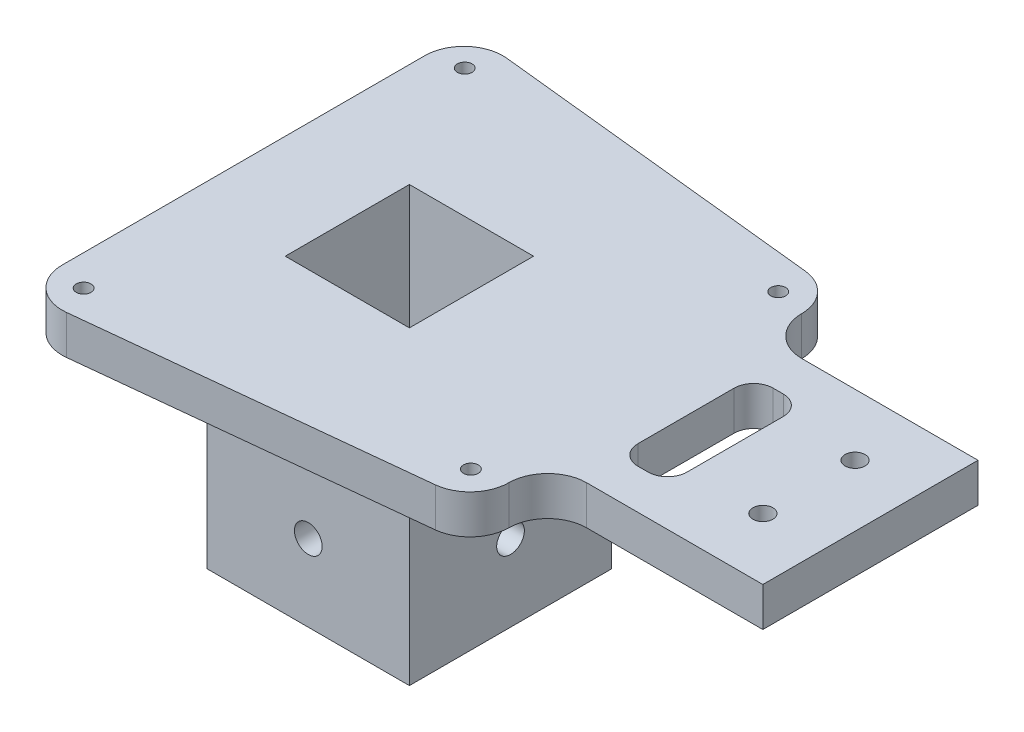
from build123d import *

# Parameters (mm, degrees)
SKETCH1_W            = 32.9
SKETCH1_H            = 32.9
SKETCH1_W_2          = 20.2
SKETCH1_H_2          = 20.2
BOSS_EXTRUDE1_DEPTH  = 25
M4_CLEARANCE_HOLE1_D = 4.5
M4_CLEARANCE_HOLE2_D = 4.5
SKETCH8_W            = 32.9
SKETCH8_H            = 32.9
SKETCH8_W_2          = 20.2
SKETCH8_H_2          = 20.2
BOSS_EXTRUDE2_DEPTH  = 12.7
SKETCH9_W            = 87.4
SKETCH9_H            = 82.4
BOSS_EXTRUDE3_DEPTH  = 6.35
M2_CLEARANCE_HOLE1_D = 2.4
SKETCH13_W           = 20.2
SKETCH13_H           = 20.2
CUT_EXTRUDE1_DEPTH   = 71.911353111
SKETCH14_W           = 87.4
SKETCH14_H           = 82.4
CUT_EXTRUDE2_DEPTH   = 75.481759512
SKETCH15_W           = 35
SKETCH15_H           = 35
SKETCH15_R           = 1.625
BOSS_EXTRUDE4_DEPTH  = 6.35
FILLET1_R            = 6.35
SKETCH16_W           = 8
SKETCH16_H           = 22
CUT_EXTRUDE3_DEPTH   = 95.077926699
FILLET2_R            = 3.175


with BuildPart() as part:
    # Sketch1 → Boss-Extrude1 (new body)
    with BuildSketch(Plane(origin=(0, 0, 0), x_dir=(1, 0, 0), z_dir=(0, 1, 0))):
        Rectangle(SKETCH1_W, SKETCH1_H)
        Rectangle(SKETCH1_W_2, SKETCH1_H_2, mode=Mode.SUBTRACT)
    extrude(amount=BOSS_EXTRUDE1_DEPTH)

    # M4 Clearance Hole1 (through all)
    with Locations(Plane.XY.offset(16.45)):
        with Locations((0, 12.5)):
            Hole(M4_CLEARANCE_HOLE1_D / 2)

    # M4 Clearance Hole2 (through all)
    with Locations(Plane(origin=(16.45, 0, 0), x_dir=(0, 0, -1), z_dir=(1, 0, 0))):
        with Locations((0, 12.5)):
            Hole(M4_CLEARANCE_HOLE2_D / 2)

    # Sketch8 → Boss-Extrude2 (add)
    with BuildSketch(Plane(origin=(0, 25, 0), x_dir=(1, 0, 0), z_dir=(0, 1, 0))):
        Rectangle(SKETCH8_W, SKETCH8_H)
        Rectangle(SKETCH8_W_2, SKETCH8_H_2, mode=Mode.SUBTRACT)
    extrude(amount=BOSS_EXTRUDE2_DEPTH)

    # Sketch9 → Boss-Extrude3 (add)
    with BuildSketch(Plane(origin=(0, 37.7, 0), x_dir=(1, 0, 0), z_dir=(0, 1, 0))):
        Rectangle(SKETCH9_W, SKETCH9_H)
    extrude(amount=BOSS_EXTRUDE3_DEPTH)

    # M2 Clearance Hole1 (through all)
    with Locations(Plane(origin=(0, 44.05, 0), x_dir=(1, 0, 0), z_dir=(0, 1, 0))):
        with Locations((35, -25), (-22, -31), (-22, 31), (35, 25)):
            Hole(M2_CLEARANCE_HOLE1_D / 2)

    # Sketch13 → Cut-Extrude1 (cut, through all)
    with BuildSketch(Plane.XZ.offset(-37.7)):
        Rectangle(SKETCH13_W, SKETCH13_H)
    extrude(amount=-CUT_EXTRUDE1_DEPTH, mode=Mode.SUBTRACT)

    # Sketch14 → Cut-Extrude2 (cut, through all)
    with BuildSketch(Plane(origin=(0, 44.05, 0), x_dir=(1, 0, 0), z_dir=(0, 1, 0))):
        Rectangle(SKETCH14_W, SKETCH14_H)
        with BuildLine():
            Line((40, 23.784646643), (40, -23.784646643))
            ThreePointArc((40, -23.784646643), (38.369303562, -28.033255108), (34.314748382, -30.099756269))
            Line((34.314748382, -30.099756269), (-19.985251618, -35.815545743))
            ThreePointArc((-19.985251618, -35.815545743), (-24.898608465, -34.219739679), (-27, -29.500436117))
            Line((-27, -29.500436117), (-27, 29.500436117))
            ThreePointArc((-27, 29.500436117), (-24.898608465, 34.219739679), (-19.985251618, 35.815545743))
            Line((-19.985251618, 35.815545743), (34.314748382, 30.099756269))
            ThreePointArc((34.314748382, 30.099756269), (38.369303562, 28.033255108), (40, 23.784646643))
        make_face(mode=Mode.SUBTRACT)
    extrude(amount=-CUT_EXTRUDE2_DEPTH, mode=Mode.SUBTRACT)

    # Sketch15 → Boss-Extrude4 (add)
    with BuildSketch(Plane(origin=(0, 44.05, 0), x_dir=(1, 0, 0), z_dir=(0, 1, 0))):
        with Locations((57.5, 0)):
            Rectangle(SKETCH15_W, SKETCH15_H)
        with Locations(Location((65, 7.5, 0), (0, 0, 270))):
            Circle(SKETCH15_R, mode=Mode.SUBTRACT)
        with Locations(Location((65, -7.5, 0), (0, 0, 270))):
            Circle(SKETCH15_R, mode=Mode.SUBTRACT)
    extrude(amount=-BOSS_EXTRUDE4_DEPTH)

    # Fillet1
    fillet1_edges = [part.edges().sort_by_distance(p)[0] for p in [
        (40, 40.875, 17.5),
        (40, 40.875, -17.5),
    ]]
    fillet(fillet1_edges, radius=FILLET1_R)

    # Sketch16 → Cut-Extrude3 (cut, through all)
    with BuildSketch(Plane(origin=(0, 44.05, 0), x_dir=(1, 0, 0), z_dir=(0, 1, 0))):
        with Locations((49, 0)):
            Rectangle(SKETCH16_W, SKETCH16_H)
    extrude(amount=-CUT_EXTRUDE3_DEPTH, mode=Mode.SUBTRACT)

    # Fillet2
    fillet2_edges = [part.edges().sort_by_distance(p)[0] for p in [
        (45, 40.875, 11),
        (45, 40.875, -11),
        (53, 40.875, -11),
        (53, 40.875, 11),
    ]]
    fillet(fillet2_edges, radius=FILLET2_R)


solid = part.part
